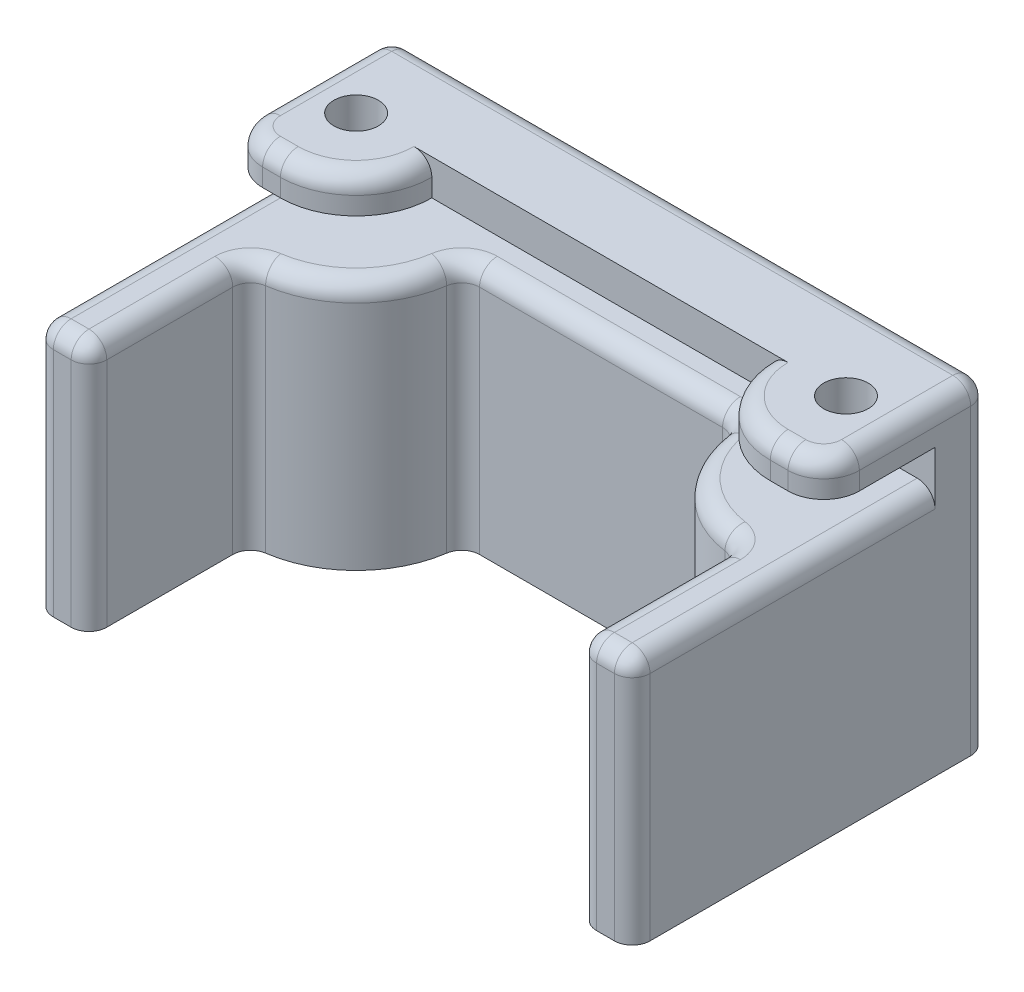
from build123d import *

# Parameters (mm, degrees)
MAIN_BODY_DEPTH                = 14
EXTENSION_FOR_TOP_FLANGE_DEPTH = 2
SKETCH4_R                      = 1.25
TOP_CAMERA_FLANGE_DEPTH        = 2
M2_SCREWHOLE_DEPTH             = 27.487025126
M2_SCREWHOLE_DEPTH_BACK        = 27.487025126
SKETCH5_R                      = 1
FILLET1_R                      = 1


with BuildPart() as part:
    # Sketch2 → Main body (new body)
    with BuildSketch(Plane(origin=(0, 0, 0), x_dir=(1, 0, 0), z_dir=(0, 1, 0))):
        with BuildLine():
            Line((-16.75, -14), (-16.75, 4))
            ThreePointArc((-16.75, 4), (-16.457106781, 4.707106781), (-15.75, 5))
            Line((-15.75, 5), (15.75, 5))
            ThreePointArc((15.75, 5), (16.457106781, 4.707106781), (16.75, 4))
            Line((16.75, 4), (16.75, -14))
            ThreePointArc((16.75, -14), (16.457106781, -14.707106781), (15.75, -15))
            Line((15.75, -15), (14.75, -15))
            ThreePointArc((14.75, -15), (14.042893219, -14.707106781), (13.75, -14))
            Line((13.75, -14), (13.75, -6.92820323))
            ThreePointArc((13.75, -6.92820323), (13.505928946, -6.27354956), (12.892857143, -5.938459912))
            ThreePointArc((12.892857143, -5.938459912), (9.507359313, -4.242640687), (7.811540088, -0.857142857))
            ThreePointArc((7.811540088, -0.857142857), (7.47645044, -0.244071054), (6.82179677, 0))
            Line((6.82179677, 0), (-6.82179677, 0))
            ThreePointArc((-6.82179677, 0), (-7.47645044, -0.244071054), (-7.811540088, -0.857142857))
            ThreePointArc((-7.811540088, -0.857142857), (-9.507359313, -4.242640687), (-12.892857143, -5.938459912))
            ThreePointArc((-12.892857143, -5.938459912), (-13.505928946, -6.27354956), (-13.75, -6.92820323))
            Line((-13.75, -6.92820323), (-13.75, -14))
            ThreePointArc((-13.75, -14), (-14.042893219, -14.707106781), (-14.75, -15))
            Line((-14.75, -15), (-15.75, -15))
            ThreePointArc((-15.75, -15), (-16.457106781, -14.707106781), (-16.75, -14))
        make_face()
    extrude(amount=MAIN_BODY_DEPTH)

    # Sketch3 → Extension for top flange (add)
    with BuildSketch(Plane(origin=(0, 14, 0), x_dir=(1, 0, 0), z_dir=(0, 1, 0))):
        with BuildLine():
            Line((16.75, 2), (16.75, 4))
            ThreePointArc((16.75, 4), (16.457106781, 4.707106781), (15.75, 5))
            Line((15.75, 5), (-15.75, 5))
            ThreePointArc((-15.75, 5), (-16.457106781, 4.707106781), (-16.75, 4))
            Line((-16.75, 4), (-16.75, 2))
            Line((-16.75, 2), (16.75, 2))
        make_face()
    extrude(amount=EXTENSION_FOR_TOP_FLANGE_DEPTH)

    # Sketch4 → Top camera flange (add)
    with BuildSketch(Plane(origin=(0, 16, 0), x_dir=(1, 0, 0), z_dir=(0, 1, 0))):
        with BuildLine():
            Line((16.75, -2.25), (16.75, 2))
            Line((16.75, 2), (16.75, 4))
            ThreePointArc((16.75, 4), (16.457106781, 4.707106781), (15.75, 5))
            Line((15.75, 5), (-15.75, 5))
            ThreePointArc((-15.75, 5), (-16.457106781, 4.707106781), (-16.75, 4))
            Line((-16.75, 4), (-16.75, 2))
            Line((-16.75, 2), (-16.75, -2.25))
            ThreePointArc((-16.75, -2.25), (-16.164213562, -3.664213562), (-14.75, -4.25))
            Line((-14.75, -4.25), (-13.75, -4.25))
            ThreePointArc((-13.75, -4.25), (-10.74479618, -3.00520382), (-9.5, 0))
            Line((-9.5, 0), (9.5, 0))
            ThreePointArc((9.5, 0), (10.74479618, -3.00520382), (13.75, -4.25))
            Line((13.75, -4.25), (14.75, -4.25))
            ThreePointArc((14.75, -4.25), (16.164213562, -3.664213562), (16.75, -2.25))
        make_face()
        with Locations(Location((-13.75, 0, 0), (0, 0, 270))):
            Circle(SKETCH4_R, mode=Mode.SUBTRACT)
        with Locations(Location((13.75, 0, 0), (0, 0, 270))):
            Circle(SKETCH4_R, mode=Mode.SUBTRACT)
    extrude(amount=TOP_CAMERA_FLANGE_DEPTH)

    # Sketch5 → M2 screwhole (cut, two sides: drawn at the far end of the back side and taken through both)
    with BuildSketch(Plane(origin=(0, 14, 0), x_dir=(1, 0, 0), z_dir=(0, 1, 0)).offset(-M2_SCREWHOLE_DEPTH_BACK)):
        with Locations(Location((-13.75, 0, 0), (0, 0, 270))):
            Circle(SKETCH5_R)
        with Locations(Location((13.75, 0, 0), (0, 0, 270))):
            Circle(SKETCH5_R)
    extrude(amount=M2_SCREWHOLE_DEPTH + M2_SCREWHOLE_DEPTH_BACK, mode=Mode.SUBTRACT)

    # Fillet1
    fillet1_edges = [part.edges().sort_by_distance(p)[0] for p in [
        (-13.505928946, 14, 6.27354956),
        (-9.507359313, 14, 4.242640687),
        (-7.47645044, 14, 0.244071054),
        (0, 14, 0),
        (7.47645044, 14, 0.244071054),
        (9.507359313, 14, 4.242640687),
        (13.505928946, 14, 6.27354956),
        (13.75, 14, 10.464101615),
        (14.042893219, 14, 14.707106781),
        (15.25, 14, 15),
        (-14.042893219, 14, 14.707106781),
        (16.457106781, 14, 14.707106781),
        (16.75, 14, 6),
        (-16.75, 14, 6),
        (16.75, 18, -0.875),
        (16.457106781, 18, -4.707106781),
        (0, 18, -5),
        (-16.457106781, 18, -4.707106781),
        (-16.75, 18, -0.875),
        (-16.457106781, 14, 14.707106781),
        (-16.164213562, 18, 3.664213562),
        (-14.25, 18, 4.25),
        (-10.74479618, 18, 3.00520382),
        (10.74479618, 18, 3.00520382),
        (14.25, 18, 4.25),
        (16.164213562, 18, 3.664213562),
        (-15.25, 14, 15),
        (-13.75, 14, 10.464101615),
    ]]
    fillet(fillet1_edges, radius=FILLET1_R)


solid = part.part
